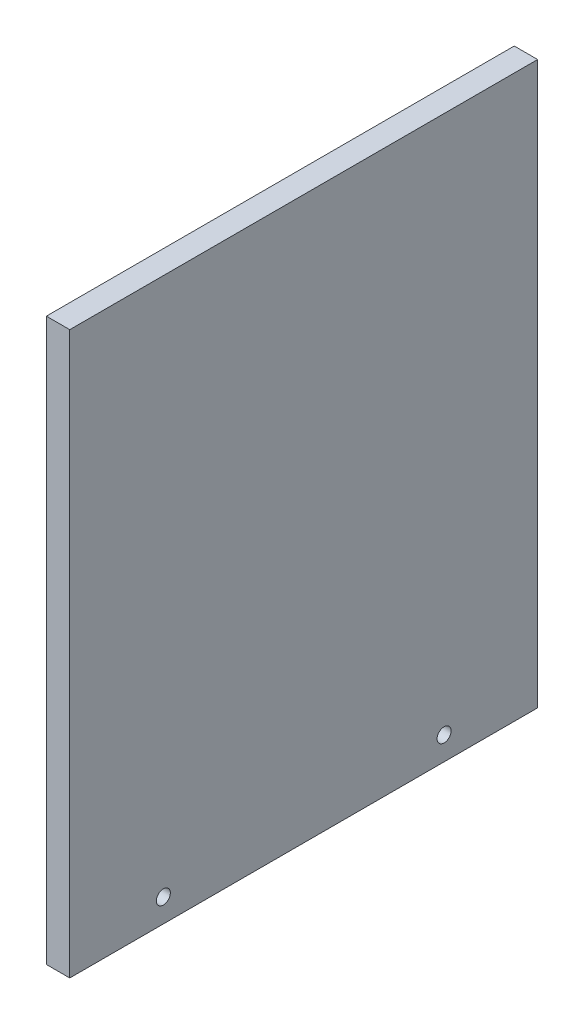
from build123d import *

# Parameters (mm, degrees)
SKETCH1_W           = 100
SKETCH1_H           = 120
BOSS_EXTRUDE1_DEPTH = 5
SKETCH2_R           = 1.5
CUT_EXTRUDE1_DEPTH  = 10


with BuildPart() as part:
    # Sketch1 → Boss-Extrude1 (new body)
    with BuildSketch(Plane(origin=(0, 0, 0), x_dir=(0, 0, -1), z_dir=(1, 0, 0))):
        with Locations((50, -60)):
            Rectangle(SKETCH1_W, SKETCH1_H)
    extrude(amount=BOSS_EXTRUDE1_DEPTH)

    # Sketch2 → Cut-Extrude1 (cut)
    with BuildSketch(Plane(origin=(5, 0, 0), x_dir=(0, 0, -1), z_dir=(1, 0, 0))):
        with Locations((20, -115)):
            Circle(SKETCH2_R)
        with Locations((80, -115)):
            Circle(SKETCH2_R)
    extrude(amount=-CUT_EXTRUDE1_DEPTH, mode=Mode.SUBTRACT)


solid = part.part
